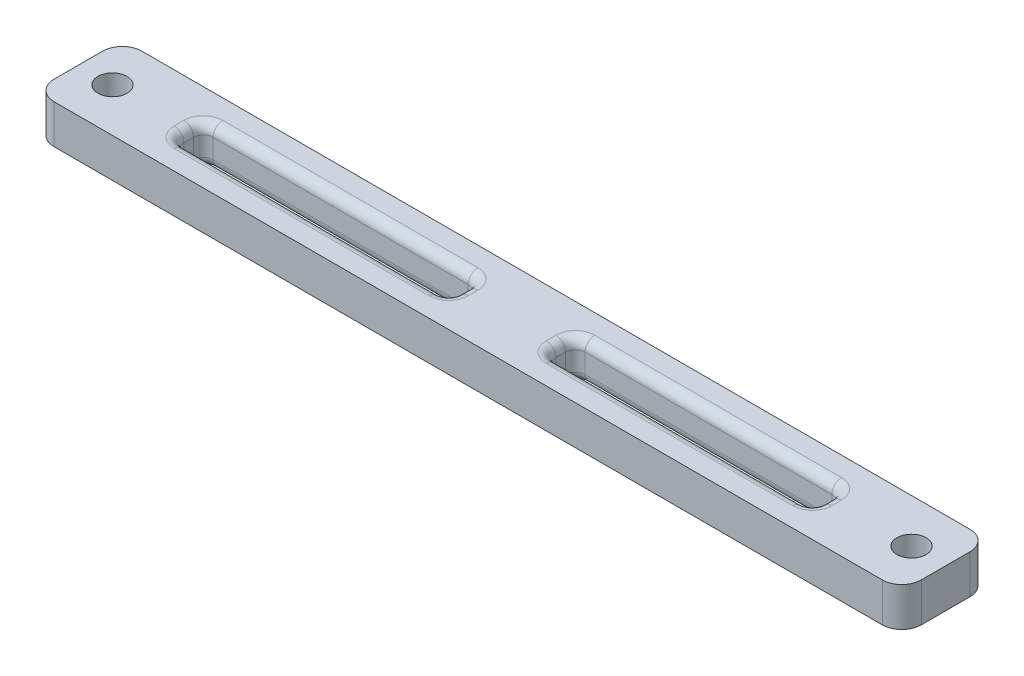
from build123d import *

# Parameters (mm, degrees)
SKETCH1_W           = 89
SKETCH1_H           = 9
BOSS_EXTRUDE1_DEPTH = 4
SKETCH2_R           = 1.5
CUT_EXTRUDE1_DEPTH  = 4
FILLET1_R           = 2
SKETCH4_W           = 28.175409777
SKETCH4_H           = 3
SKETCH4_W_2         = 27.315943202
CUT_EXTRUDE2_DEPTH  = 45.905456239
FILLET3_R           = 1


with BuildPart() as part:
    # Sketch1 → Boss-Extrude1 (new body)
    with BuildSketch(Plane(origin=(0, 0, 0), x_dir=(1, 0, 0), z_dir=(0, 1, 0))):
        Rectangle(SKETCH1_W, SKETCH1_H)
    extrude(amount=BOSS_EXTRUDE1_DEPTH)

    # Sketch2 → Cut-Extrude1 (cut)
    with BuildSketch(Plane(origin=(0, 4, 0), x_dir=(1, 0, 0), z_dir=(0, 1, 0))):
        with Locations(Location((-41, 0, 0), (0, 0, 270))):
            Circle(SKETCH2_R)
        with Locations(Location((41, 0, 0), (0, 0, 270))):
            Circle(SKETCH2_R)
    extrude(amount=-CUT_EXTRUDE1_DEPTH, mode=Mode.SUBTRACT)

    # Fillet1
    fillet1_edges = [part.edges().sort_by_distance(p)[0] for p in [
        (-44.5, 2, -4.5),
        (44.5, 2, -4.5),
        (44.5, 2, 4.5),
        (-44.5, 2, 4.5),
    ]]
    fillet(fillet1_edges, radius=FILLET1_R)

    # Sketch4 → Cut-Extrude2 (cut, through all)
    with BuildSketch(Plane(origin=(0, 4, 0), x_dir=(1, 0, 0), z_dir=(0, 1, 0))):
        with Locations((-19.087704888, 0)):
            Rectangle(SKETCH4_W, SKETCH4_H)
        with Locations((18.657971601, 0)):
            Rectangle(SKETCH4_W_2, SKETCH4_H)
    extrude(amount=-CUT_EXTRUDE2_DEPTH, mode=Mode.SUBTRACT)

    # Fillet3
    fillet3_edges = [part.edges().sort_by_distance(p)[0] for p in [
        (-33.175409777, 0, 0),
        (-33.175409777, 2, 1.5),
        (-19.087704888, 0, -1.5),
        (-33.175409777, 2, -1.5),
        (-5, 0, 0),
        (-5, 2, -1.5),
        (-19.087704888, 0, 1.5),
        (-5, 2, 1.5),
        (-33.175409777, 4, 0),
        (-19.087704888, 4, 1.5),
        (-5, 4, 0),
        (-19.087704888, 4, -1.5),
        (18.657971601, 0, 1.5),
        (32.315943202, 2, 1.5),
        (5, 0, 0),
        (5, 2, 1.5),
        (18.657971601, 0, -1.5),
        (5, 2, -1.5),
        (32.315943202, 0, 0),
        (32.315943202, 2, -1.5),
        (18.657971601, 4, 1.5),
        (32.315943202, 4, 0),
        (18.657971601, 4, -1.5),
        (5, 4, 0),
    ]]
    fillet(fillet3_edges, radius=FILLET3_R)


solid = part.part
